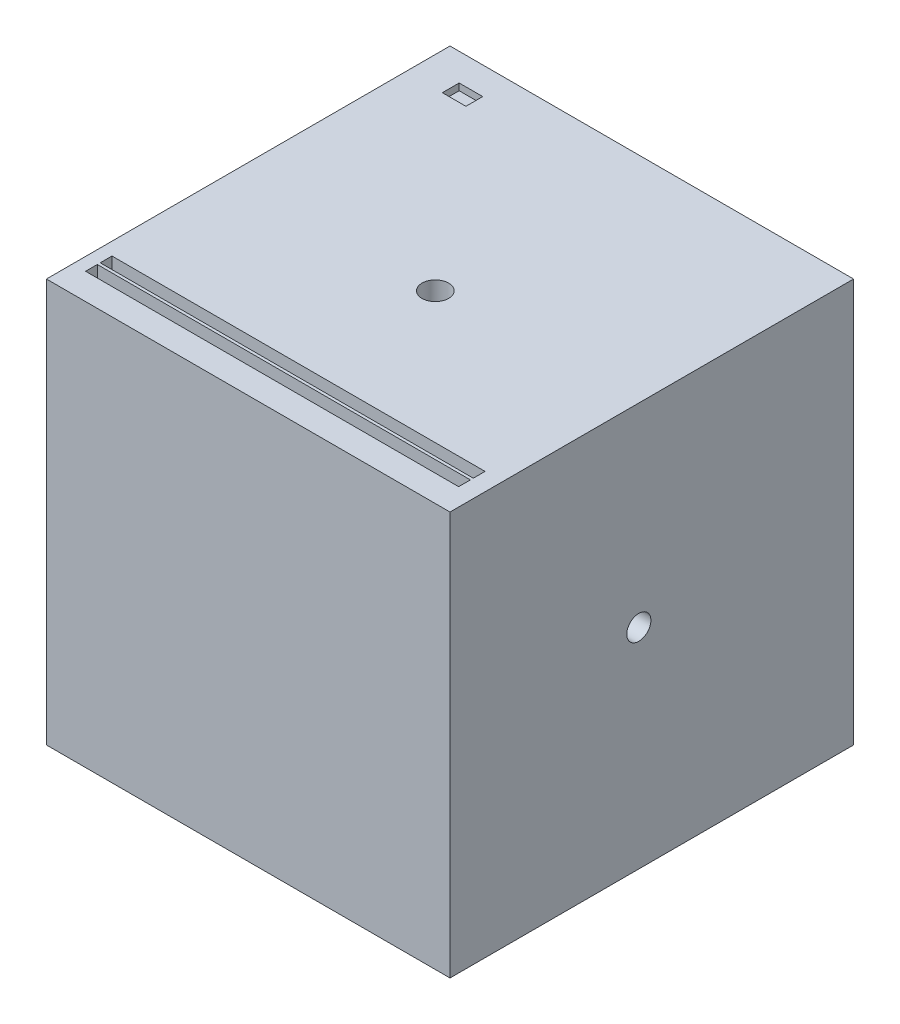
from build123d import *

# Parameters (mm, degrees)
ESBO_O1_W                = 120
ESBO_O1_H                = 120
RESSALTO_EXTRUS_O1_DEPTH = 120
ESBO_O2_W                = 55
ESBO_O2_H                = 88
CORTE_EXTRUS_O2_DEPTH    = 5
ESBO_O3_W                = 110.936399694
ESBO_O3_H                = 3.5
CORTE_EXTRUS_O3_DEPTH    = 142
ESBO_O4_W                = 7
ESBO_O4_H                = 5
CORTE_EXTRUS_O5_DEPTH    = 2
ESBO_O5_W                = 5
ESBO_O5_H                = 12
CORTE_EXTRUS_O6_DEPTH    = 10
ESBO_O6_R                = 3.961568313
CORTE_EXTRUS_O7_DEPTH    = 230
ESBO_O7_R                = 3.592178765
CORTE_EXTRUS_O8_DEPTH    = 90


with BuildPart() as part:
    # Esboço1 → Ressalto-extrusão1 (new body)
    with BuildSketch(Plane.XY):
        with Locations((-12.702949292, -5.410650407)):
            Rectangle(ESBO_O1_W, ESBO_O1_H)
    extrude(amount=RESSALTO_EXTRUS_O1_DEPTH)

    # Esboço2 → Corte-extrusão2 (cut)
    with BuildSketch(Plane.ZY.offset(72.702949292)):
        with Locations((61.153940809, -6.205937977)):
            Rectangle(ESBO_O2_W, ESBO_O2_H)
    extrude(amount=-CORTE_EXTRUS_O2_DEPTH, mode=Mode.SUBTRACT)

    # Esboço3 → Corte-extrusão3 (cut)
    with BuildSketch(Plane(origin=(0, 54.589349593, 0), x_dir=(1, 0, 0), z_dir=(0, 1, 0))):
        with Locations((-13.409376007, -110.441569905)):
            Rectangle(ESBO_O3_W, ESBO_O3_H)
        with Locations((-13.409376007, -106.084018742)):
            Rectangle(ESBO_O3_W, ESBO_O3_H)
    extrude(amount=-CORTE_EXTRUS_O3_DEPTH, mode=Mode.SUBTRACT)

    # Esboço4 → Corte-extrusão5 (cut)
    with BuildSketch(Plane(origin=(0, 54.589349593, 0), x_dir=(1, 0, 0), z_dir=(0, 1, 0))):
        with Locations((-58.31528793, -10.660946626)):
            Rectangle(ESBO_O4_W, ESBO_O4_H)
    extrude(amount=-CORTE_EXTRUS_O5_DEPTH, mode=Mode.SUBTRACT)

    # Esboço5 → Corte-extrusão6 (cut)
    with BuildSketch(Plane.ZY.offset(72.702949292)):
        with Locations((12.892561397, -49.999881636)):
            Rectangle(ESBO_O5_W, ESBO_O5_H)
    extrude(amount=-CORTE_EXTRUS_O6_DEPTH, mode=Mode.SUBTRACT)

    # Esboço6 → Corte-extrusão7 (cut)
    with BuildSketch(Plane(origin=(0, 54.589349593, 0), x_dir=(1, 0, 0), z_dir=(0, 1, 0))):
        with Locations(Location((-11.856000819, -65.210905781, 0), (0, 0, 270))):
            Circle(ESBO_O6_R)
    extrude(amount=-CORTE_EXTRUS_O7_DEPTH, mode=Mode.SUBTRACT)

    # Esboço7 → Corte-extrusão8 (cut)
    with BuildSketch(Plane(origin=(47.297050708, 0, 0), x_dir=(0, 0, -1), z_dir=(1, 0, 0))):
        with Locations(Location((-63.849475515, -3.180838573, 0), (0, 0, 90))):
            Circle(ESBO_O7_R)
    extrude(amount=-CORTE_EXTRUS_O8_DEPTH, mode=Mode.SUBTRACT)


solid = part.part
